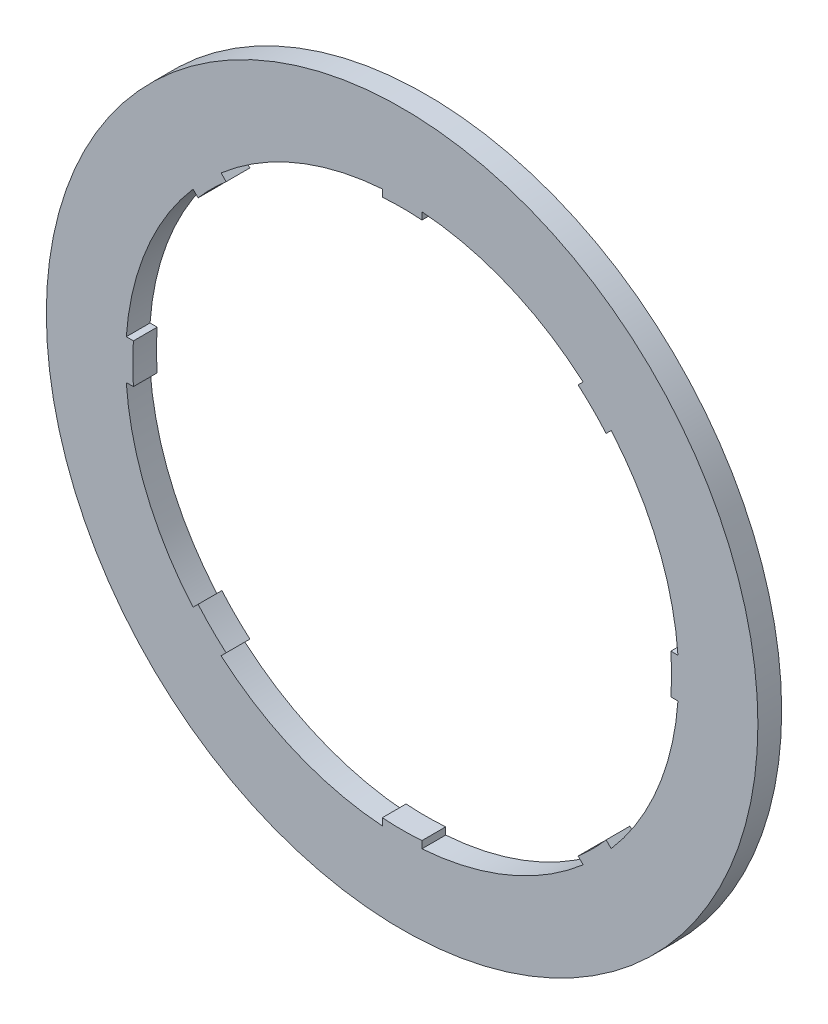
from build123d import *

# Parameters (mm, degrees)
CROQUIS1_R              = 44.9
SALIENTE_EXTRUIR1_DEPTH = 3


with BuildPart() as part:
    # Croquis1 → Saliente-Extruir1 (new body)
    with BuildSketch(Plane.XY):
        Circle(CROQUIS1_R)
        with BuildLine():
            Line((-2.5, 33.907963666), (-2.5, 34.81034329))
            ThreePointArc((-2.5, 34.81034329), (-13.35565179, 32.243395685), (-22.846862843, 26.382396749))
            Line((-22.846862843, 26.382396749), (-22.208784092, 25.744317998))
            ThreePointArc((-22.208784092, 25.744317998), (-24.04163056, 24.04163056), (-25.744317998, 22.208784092))
            Line((-25.744317998, 22.208784092), (-26.382396749, 22.846862843))
            ThreePointArc((-26.382396749, 22.846862843), (-32.243395685, 13.35565179), (-34.81034329, 2.5))
            Line((-34.81034329, 2.5), (-33.907963666, 2.5))
            ThreePointArc((-33.907963666, 2.5), (-34, 0), (-33.907963666, -2.5))
            Line((-33.907963666, -2.5), (-34.81034329, -2.5))
            ThreePointArc((-34.81034329, -2.5), (-32.243395685, -13.35565179), (-26.382396749, -22.846862843))
            Line((-26.382396749, -22.846862843), (-25.744317998, -22.208784092))
            ThreePointArc((-25.744317998, -22.208784092), (-24.04163056, -24.04163056), (-22.208784092, -25.744317998))
            Line((-22.208784092, -25.744317998), (-22.846862843, -26.382396749))
            ThreePointArc((-22.846862843, -26.382396749), (-13.35565179, -32.243395685), (-2.5, -34.81034329))
            Line((-2.5, -34.81034329), (-2.5, -33.907963666))
            ThreePointArc((-2.5, -33.907963666), (0, -34), (2.5, -33.907963666))
            Line((2.5, -33.907963666), (2.5, -34.81034329))
            ThreePointArc((2.5, -34.81034329), (13.35565179, -32.243395685), (22.846862843, -26.382396749))
            Line((22.846862843, -26.382396749), (22.208784092, -25.744317998))
            ThreePointArc((22.208784092, -25.744317998), (24.04163056, -24.04163056), (25.744317998, -22.208784092))
            Line((25.744317998, -22.208784092), (26.382396749, -22.846862843))
            ThreePointArc((26.382396749, -22.846862843), (32.243395685, -13.35565179), (34.81034329, -2.5))
            Line((34.81034329, -2.5), (33.907963666, -2.5))
            ThreePointArc((33.907963666, -2.5), (34, 0), (33.907963666, 2.5))
            Line((33.907963666, 2.5), (34.81034329, 2.5))
            ThreePointArc((34.81034329, 2.5), (32.243395685, 13.35565179), (26.382396749, 22.846862843))
            Line((26.382396749, 22.846862843), (25.744317998, 22.208784092))
            ThreePointArc((25.744317998, 22.208784092), (24.04163056, 24.04163056), (22.208784092, 25.744317998))
            Line((22.208784092, 25.744317998), (22.846862843, 26.382396749))
            ThreePointArc((22.846862843, 26.382396749), (13.35565179, 32.243395685), (2.5, 34.81034329))
            Line((2.5, 34.81034329), (2.5, 33.907963666))
            ThreePointArc((2.5, 33.907963666), (0, 34), (-2.5, 33.907963666))
        make_face(mode=Mode.SUBTRACT)
    extrude(amount=SALIENTE_EXTRUIR1_DEPTH)


solid = part.part
